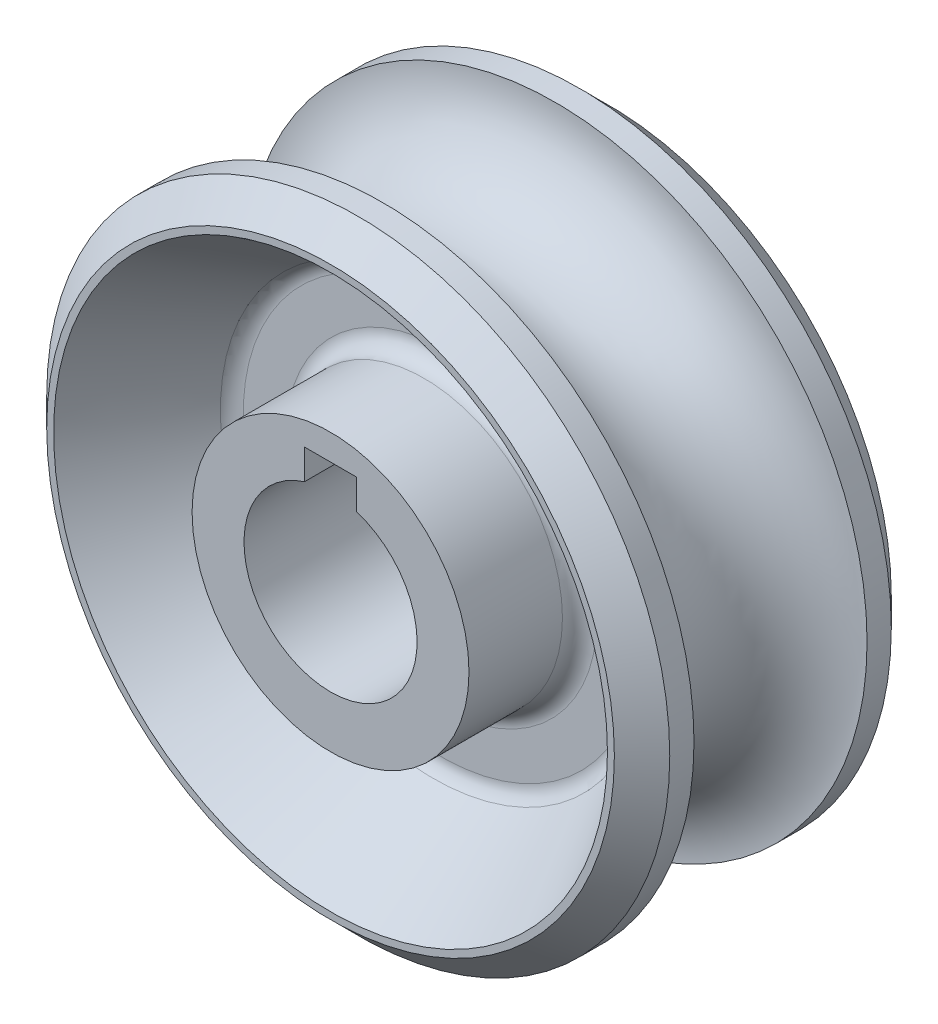
from build123d import *

# Parameters (mm, degrees)
BASE_SKETCH_R      = 28.575
BASE_SKETCH_R_2    = 7.9375
BASE_DEPTH         = 12.7
GROOVE_SKETCH_R    = 7.9375
OUTER_CHAMFER_SIZE = 2.54
INNER_FILLET_R     = 1.5875
KEYWAY_DEPTH       = 43.359783404
KEYWAY_DEPTH_BACK  = 43.359783404
KEYWAY_SKETCH_W    = 4.7752
KEYWAY_SKETCH_H    = 10.3251


with BuildPart() as part:
    # Base Sketch → Base (new, symmetric)
    with BuildSketch(Plane.XY):
        Circle(BASE_SKETCH_R)
        Circle(BASE_SKETCH_R_2, mode=Mode.SUBTRACT)
    extrude(amount=BASE_DEPTH, both=True)

    # Groove Sketch → Groove (revolve, cut)
    with BuildSketch(Plane(origin=(0, 0, 0), x_dir=(0, 0, -1), z_dir=(1, 0, 0)), mode=Mode.PRIVATE) as groove_sk:
        with Locations((0, 28.575)):
            Circle(GROOVE_SKETCH_R)
    revolve(groove_sk.sketch.rotate(Axis((0, 0, 0), (0, 0, -1)), 90), axis=Axis((0, 0, 0), (0, 0, -1)), mode=Mode.SUBTRACT)

    # Inner Sketch → Inner Revolved Cut (revolve, cut)
    with BuildSketch(Plane(origin=(0, 0, 0), x_dir=(0, 0, -1), z_dir=(1, 0, 0)), mode=Mode.PRIVATE) as inner_revolved_cut_sk:
        Polygon((12.7, 12.7), (2.54, 12.7), (2.54, 19.05), (12.7, 25.4), align=None)
        Polygon((-12.7, 25.4), (-12.7, 12.7), (-2.54, 12.7), (-2.54, 19.05), align=None)
    revolve(inner_revolved_cut_sk.sketch.rotate(Axis((0, 0, 0), (0, 0, -1)), 90), axis=Axis((0, 0, 0), (0, 0, -1)), mode=Mode.SUBTRACT)

    # Outer Chamfer
    outer_chamfer_edges = [part.edges().sort_by_distance(p)[0] for p in [
        (-28.575, 0, -12.7),
        (-28.575, 0, 12.7),
    ]]
    chamfer(outer_chamfer_edges, length=OUTER_CHAMFER_SIZE)

    # Inner Fillet
    inner_fillet_edges = [part.edges().sort_by_distance(p)[0] for p in [
        (-12.7, 0, -2.54),
        (-19.05, 0, -2.54),
        (-19.05, 0, 2.54),
        (-12.7, 0, 2.54),
    ]]
    fillet(inner_fillet_edges, radius=INNER_FILLET_R)

    # Keyway Sketch → Keyway (cut, two sides: drawn at the far end of the back side and taken through both)
    with BuildSketch(Plane.XY.offset(-KEYWAY_DEPTH_BACK)):
        with Locations((0, 5.16255)):
            Rectangle(KEYWAY_SKETCH_W, KEYWAY_SKETCH_H)
    extrude(amount=KEYWAY_DEPTH + KEYWAY_DEPTH_BACK, mode=Mode.SUBTRACT)


solid = part.part
